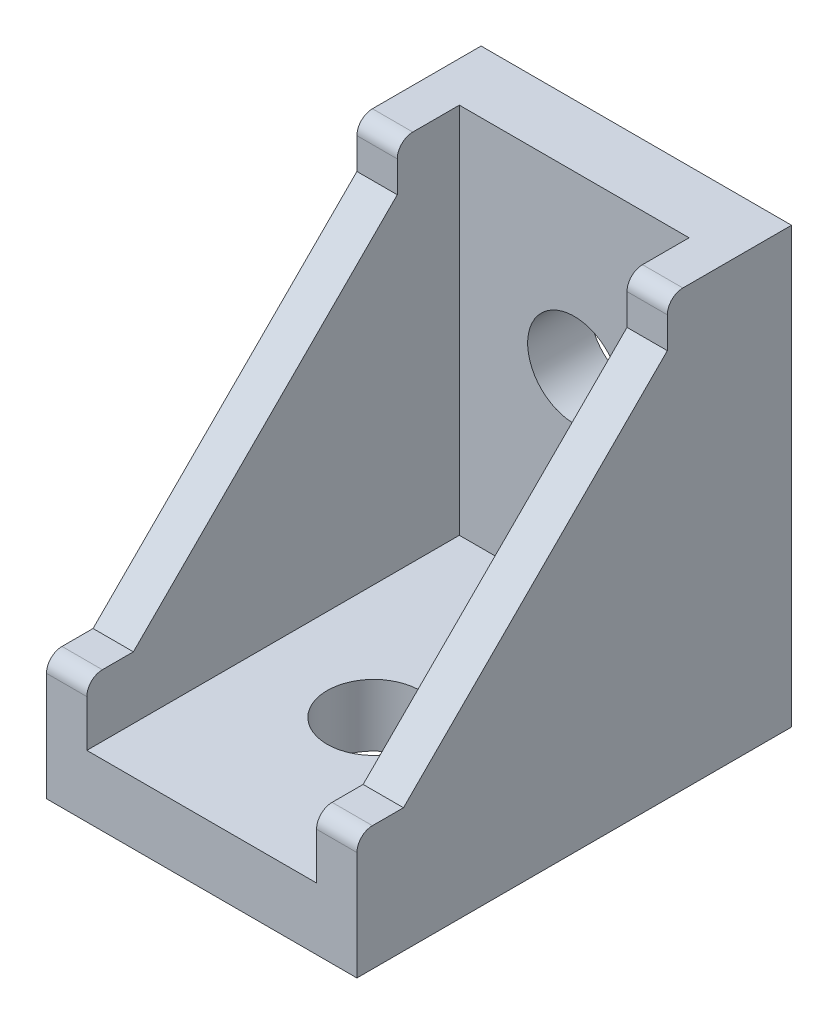
from build123d import *

# Parameters (mm, degrees)
SKETCH_1_W          = 20
SKETCH_1_H          = 28
EXTRUDE_1_DEPTH     = 4
SKETCH_2_W          = 20
SKETCH_2_H          = 4
EXTRUDE_2_DEPTH     = 24
EXTRUDE_3_DEPTH     = 2.6
FILLET_1_R          = 1
SKETCH_4_R          = 3
CUT_EXTRUDE_1_DEPTH = 30.52964612


with BuildPart() as part:
    # 草图1 → 凸台-拉伸1 (new body)
    with BuildSketch(Plane.XY):
        Rectangle(SKETCH_1_W, SKETCH_1_H)
    extrude(amount=EXTRUDE_1_DEPTH)

    # 草图2 → 凸台-拉伸2 (add)
    with BuildSketch(Plane.XY.offset(4)):
        with Locations((0, -12)):
            Rectangle(SKETCH_2_W, SKETCH_2_H)
    extrude(amount=EXTRUDE_2_DEPTH)

    # 草图3 → 凸台-拉伸3 (add)
    with BuildSketch(Plane.ZY.offset(10)):
        Polygon((4, 14), (8, 14), (8, 11), (25, -6), (28, -6), (28, -10), (4, -10), align=None)
    extrude_3 = extrude(amount=-EXTRUDE_3_DEPTH)

    # 镜向1: 凸台-拉伸3 across plane
    add(extrude_3.mirror(Plane(origin=(0, 0, 0), x_dir=(0, 0, 1), z_dir=(1, 0, 0))))

    # 圆角1
    fillet_1_edges = [part.edges().sort_by_distance(p)[0] for p in [
        (-8.7, 14, 8),
        (-8.7, -6, 28),
        (8.7, -6, 28),
        (8.7, 14, 8),
    ]]
    fillet(fillet_1_edges, radius=FILLET_1_R)

    # 草图4 → 切除-拉伸1 (cut, through all)
    with BuildSketch(Plane.XY.offset(4)):
        with Locations((0, 2.920534958)):
            Circle(SKETCH_4_R)
    cut_extrude_1 = extrude(amount=-CUT_EXTRUDE_1_DEPTH, mode=Mode.SUBTRACT)

    # 镜向2: 切除-拉伸1 across plane
    add(cut_extrude_1.mirror(Plane(origin=(0, -7, 7), x_dir=(0, 0.7071067811865476, 0.7071067811865476), z_dir=(0, -0.7071067811865477, 0.7071067811865475))), mode=Mode.SUBTRACT)


solid = part.part
